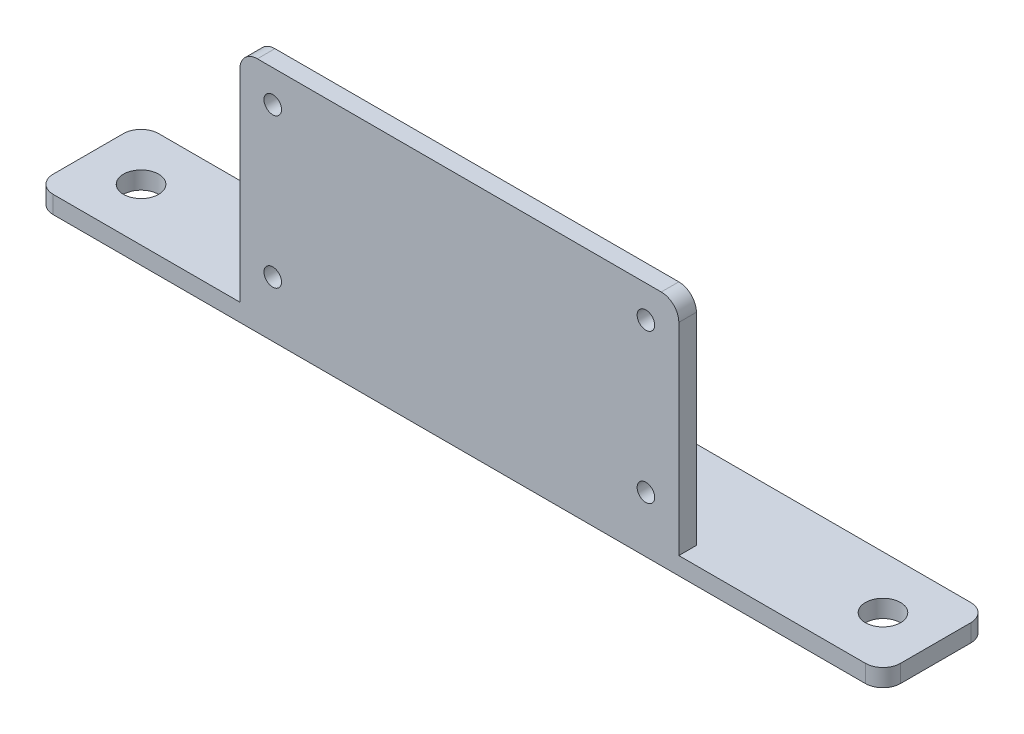
from build123d import *

# Parameters (mm, degrees)
SKETCH3_R           = 2
BOSS_EXTRUDE1_DEPTH = 2
SKETCH4_W           = 25
SKETCH4_H           = 2
BOSS_EXTRUDE2_DEPTH = 25
CUT_EXTRUDE1_REACH  = 58.578
SKETCH6_R           = 1
FILLET1_R           = 2


with BuildPart() as part:
    # Sketch3 → Boss-Extrude1 (new body)
    with BuildSketch(Plane(origin=(0, 0, 0), x_dir=(1, 0, 0), z_dir=(0, 1, 0))):
        with BuildLine():
            ThreePointArc((8.728627884, 6), (8.109373095, 2.770911469), (6.339475115, 0))
            ThreePointArc((6.339475115, 0), (0, -2.728627884), (-6.339475115, 0))
            ThreePointArc((-6.339475115, 0), (-8.109373095, 2.770911469), (-8.728627884, 6))
            Line((-8.728627884, 6), (-48.25, 6))
            Line((-48.25, 6), (-48.25, -6))
            Line((-48.25, -6), (48.25, -6))
            Line((48.25, -6), (48.25, 6))
            Line((48.25, 6), (8.728627884, 6))
        make_face()
        with Locations(Location((-42.25, 0, 0), (0, 0, 270))):
            Circle(SKETCH3_R, mode=Mode.SUBTRACT)
        with BuildLine():
            ThreePointArc((44.25, 0), (42.25, -2), (40.25, 0))
            ThreePointArc((40.25, 0), (42.25, 2), (44.25, 0))
        make_face(mode=Mode.SUBTRACT)
    extrude(amount=BOSS_EXTRUDE1_DEPTH)

    # Sketch4 → Boss-Extrude2 (add)
    with BuildSketch(Plane(origin=(0, 2, 0), x_dir=(1, 0, 0), z_dir=(0, 1, 0))):
        with Locations((-12.5, -5)):
            Rectangle(SKETCH4_W, SKETCH4_H)
        with Locations((12.5, -5)):
            Rectangle(SKETCH4_W, SKETCH4_H)
    extrude(amount=BOSS_EXTRUDE2_DEPTH)

    # Sketch6 → Cut-Extrude1 (cut, up to next)
    with BuildSketch(Plane.XY.offset(6), mode=Mode.PRIVATE) as cut_extrude1_sk1:
        with Locations((21.25, 23.354759591)):
            Circle(SKETCH6_R)
    cut_extrude1_tool1 = extrude(cut_extrude1_sk1.sketch, amount=-CUT_EXTRUDE1_REACH, mode=Mode.PRIVATE) & part.part
    # Sketch6 → Cut-Extrude1 (cut, up to next)
    with BuildSketch(Plane.XY.offset(6), mode=Mode.PRIVATE) as cut_extrude1_sk2:
        with Locations((-21.25, 23.354759591)):
            Circle(SKETCH6_R)
    cut_extrude1_tool2 = extrude(cut_extrude1_sk2.sketch, amount=-CUT_EXTRUDE1_REACH, mode=Mode.PRIVATE) & part.part
    # Sketch6 → Cut-Extrude1 (cut, up to next)
    with BuildSketch(Plane.XY.offset(6), mode=Mode.PRIVATE) as cut_extrude1_sk3:
        with Locations((21.25, 6.354759591)):
            Circle(SKETCH6_R)
    cut_extrude1_tool3 = extrude(cut_extrude1_sk3.sketch, amount=-CUT_EXTRUDE1_REACH, mode=Mode.PRIVATE) & part.part
    # Sketch6 → Cut-Extrude1 (cut, up to next)
    with BuildSketch(Plane.XY.offset(6), mode=Mode.PRIVATE) as cut_extrude1_sk4:
        with Locations((-21.25, 6.354759591)):
            Circle(SKETCH6_R)
    cut_extrude1_tool4 = extrude(cut_extrude1_sk4.sketch, amount=-CUT_EXTRUDE1_REACH, mode=Mode.PRIVATE) & part.part
    add(cut_extrude1_tool1.solids().sort_by_distance((21.25, 23.35476, 6))[0], mode=Mode.SUBTRACT)
    add(cut_extrude1_tool2.solids().sort_by_distance((-21.25, 23.35476, 6))[0], mode=Mode.SUBTRACT)
    add(cut_extrude1_tool3.solids().sort_by_distance((21.25, 6.35476, 6))[0], mode=Mode.SUBTRACT)
    add(cut_extrude1_tool4.solids().sort_by_distance((-21.25, 6.35476, 6))[0], mode=Mode.SUBTRACT)

    # Fillet1
    fillet1_edges = [part.edges().sort_by_distance(p)[0] for p in [
        (8.728627884, 1, -6),
        (48.25, 1, -6),
        (48.25, 1, 6),
        (-48.25, 1, 6),
        (-48.25, 1, -6),
        (-8.728627884, 1, -6),
        (25, 27, 5),
        (-25, 27, 5),
    ]]
    fillet(fillet1_edges, radius=FILLET1_R)


solid = part.part
